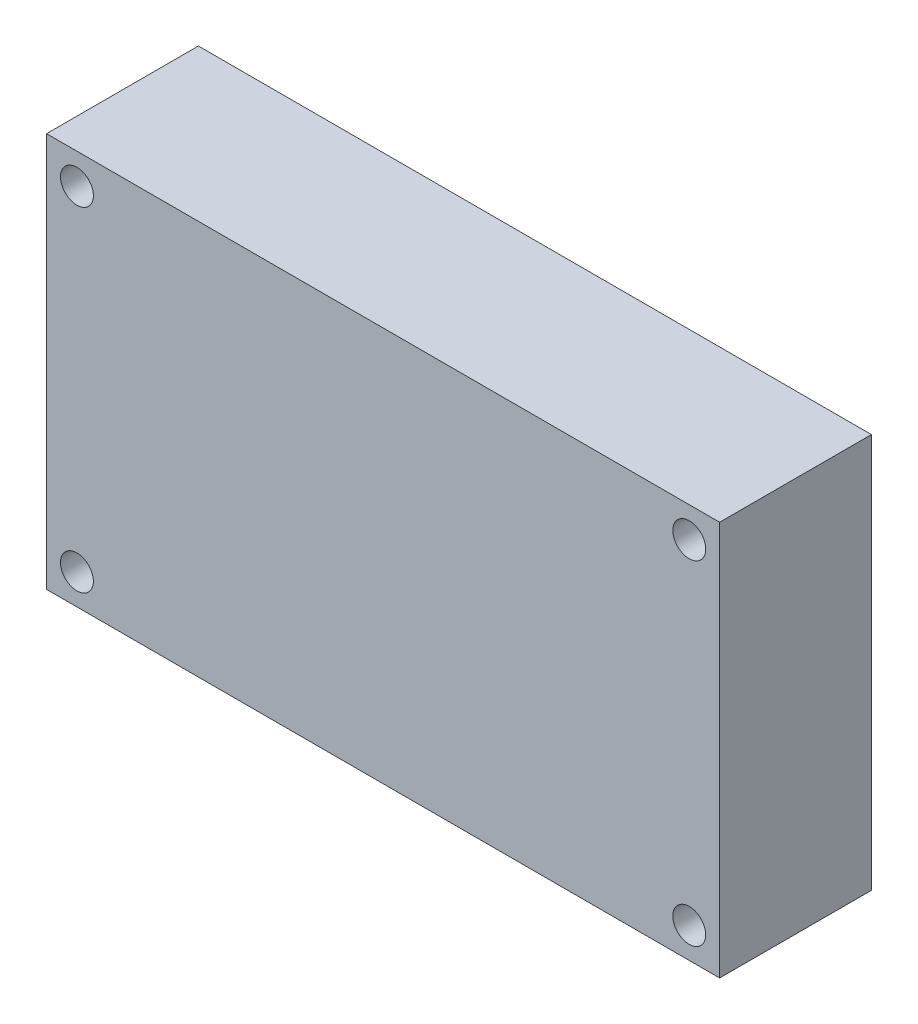
from build123d import *

# Parameters (mm, degrees)
SKETCH_1_W      = 66.5
SKETCH_1_H      = 39
SKETCH_1_R      = 1.625
EXTRUDE_1_DEPTH = 15


with BuildPart() as part:
    # 草图1 → 凸台-拉伸1 (new body)
    with BuildSketch(Plane.XY):
        Rectangle(SKETCH_1_W, SKETCH_1_H)
        with Locations((-30.25, 16.5)):
            Circle(SKETCH_1_R, mode=Mode.SUBTRACT)
        with Locations((30.25, 16.5)):
            Circle(SKETCH_1_R, mode=Mode.SUBTRACT)
        with Locations((30.25, -16.5)):
            Circle(SKETCH_1_R, mode=Mode.SUBTRACT)
        with Locations((-30.25, -16.5)):
            Circle(SKETCH_1_R, mode=Mode.SUBTRACT)
    extrude(amount=EXTRUDE_1_DEPTH)


solid = part.part
